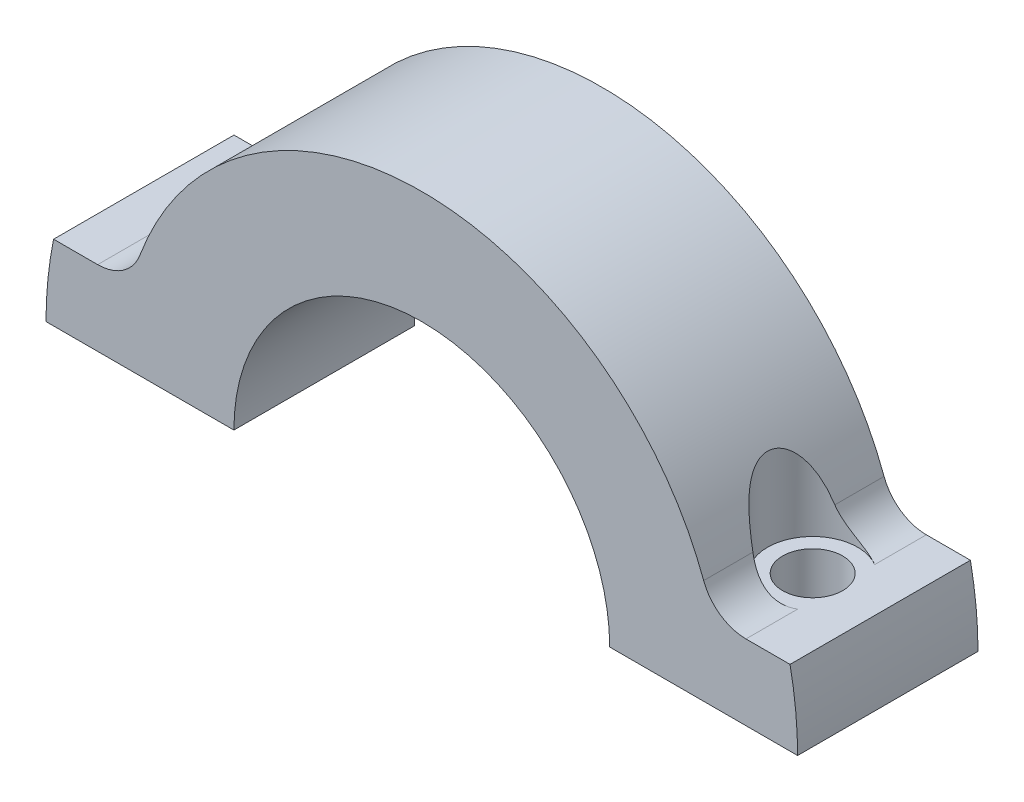
from build123d import *

# Parameters (mm, degrees)
BOSS_EXTRUDE1_DEPTH = 12
SKETCH3_R           = 2
CUT_EXTRUDE1_DEPTH  = 10
SKETCH4_R           = 3
CUT_EXTRUDE2_DEPTH  = 10


with BuildPart() as part:
    # Sketch2 → Boss-Extrude1 (new body)
    with BuildSketch(Plane.XY):
        with BuildLine():
            Line((-25, 0), (-12.5, 0))
            ThreePointArc((-12.5, 0), (0, 12.5), (12.5, 0))
            Line((12.5, 0), (25, 0))
            ThreePointArc((25, 0), (24.873403825, 2.51272405), (24.494897428, 5))
            Line((24.494897428, 5), (21.563858653, 5))
            ThreePointArc((21.563858653, 5), (19.850737931, 5.537233793), (18.751181437, 6.956521739))
            ThreePointArc((18.751181437, 6.956521739), (0, 20), (-18.751181437, 6.956521739))
            ThreePointArc((-18.751181437, 6.956521739), (-19.850737931, 5.537233793), (-21.563858653, 5))
            Line((-21.563858653, 5), (-24.494897428, 5))
            ThreePointArc((-24.494897428, 5), (-24.873403825, 2.51272405), (-25, 0))
        make_face()
    extrude(amount=BOSS_EXTRUDE1_DEPTH)

    # Sketch3 → Cut-Extrude1 (cut)
    with BuildSketch(Plane(origin=(0, 0, 0), x_dir=(1, 0, 0), z_dir=(0, 1, 0))):
        with Locations(Location((20, -6, 0), (0, 0, 128.638810709))):
            Circle(SKETCH3_R)
        with Locations(Location((-20, -6, 0), (0, 0, 90))):
            Circle(SKETCH3_R)
    extrude(amount=CUT_EXTRUDE1_DEPTH, mode=Mode.SUBTRACT)

    # Sketch4 → Cut-Extrude2 (cut)
    with BuildSketch(Plane(origin=(0, 5, 0), x_dir=(1, 0, 0), z_dir=(0, 1, 0))):
        with Locations((20, -6)):
            Circle(SKETCH4_R)
        with Locations((-20, -6)):
            Circle(SKETCH4_R)
    extrude(amount=CUT_EXTRUDE2_DEPTH, mode=Mode.SUBTRACT)


solid = part.part
